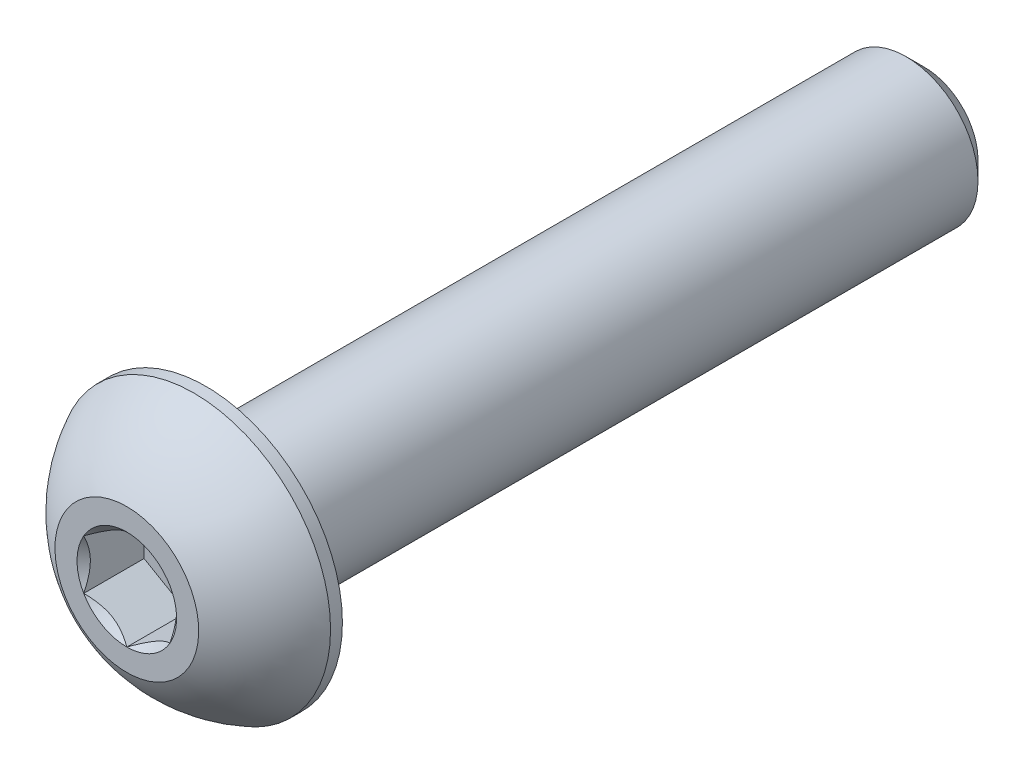
from build123d import *

# Parameters (mm, degrees)
CUT_EXTRUDE1_DEPTH = 2.1


with BuildPart() as part:
    # Sketch2 → Revolve1 (revolve)
    with BuildSketch(Plane(origin=(0, 0, 0), x_dir=(0, 0, -1), z_dir=(1, 0, 0)), mode=Mode.PRIVATE) as revolve1_sk:
        with BuildLine():
            Line((-13.875, 0), (13.875, 0))
            Line((13.875, 0), (13.875, 1.86))
            Line((13.875, 1.86), (13.235, 2.5))
            Line((13.235, 2.5), (-11.125, 2.5))
            Line((-11.125, 2.5), (-11.125, 4.75))
            Line((-11.125, 4.75), (-11.5375, 4.75))
            ThreePointArc((-11.5375, 4.75), (-12.883124817, 3.808753282), (-13.875, 2.5))
            Line((-13.875, 2.5), (-13.875, 0))
        make_face()
    revolve(revolve1_sk.sketch.rotate(Axis((0, 0, 13.875), (0, 0, -1)), 90), axis=Axis((0, 0, 13.875), (0, 0, -1)))

    # Sketch3 → Cut-Extrude1 (cut)
    with BuildSketch(Plane.XY.offset(13.875)):
        Polygon((0, 1.732050808), (-1.5, 0.866025404), (-1.5, -0.866025404), (0, -1.732050808), (1.5, -0.866025404), (1.5, 0.866025404), align=None)
    extrude(amount=-CUT_EXTRUDE1_DEPTH, mode=Mode.SUBTRACT)

    # Cut-Extrude2 cone 1 section (through the dimple's axis) → Cut-Extrude2 (revolve, cut)
    with BuildSketch(Plane(origin=(0, 0, 13.875), x_dir=(0, -1, 0), z_dir=(1, 0, 0))):
        Polygon((0, 0), (1.732050808, 0), (0, 1.732050808), align=None)
    revolve(axis=Axis((0, 0, 13.875), (0, 0, -1)), mode=Mode.SUBTRACT)


solid = part.part
